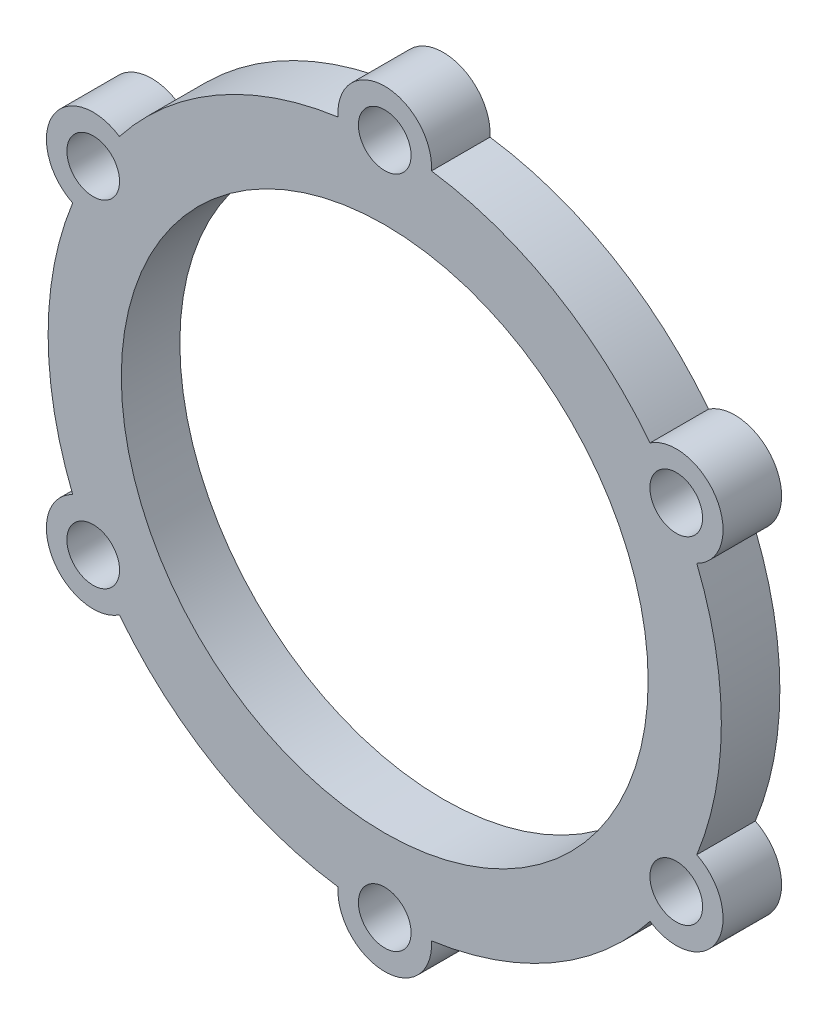
from build123d import *

# Parameters (mm, degrees)
SKETCH2_R           = 45
SKETCH2_R_2         = 4.5
BOSS_EXTRUDE1_DEPTH = 10


with BuildPart() as part:
    # Sketch2 → Boss-Extrude1 (new body)
    with BuildSketch(Plane(origin=(0, 0, 0), x_dir=(0, 1, 0), z_dir=(0, 0, 1))):
        with BuildLine():
            ThreePointArc((56.943478261, 7.980619246), (49.796460718, 28.75), (35.383158136, 45.324189131))
            ThreePointArc((35.383158136, 45.324189131), (32.75, 56.724663948), (21.560320125, 53.304808377))
            ThreePointArc((21.560320125, 53.304808377), (0, 57.5), (-21.560320125, 53.304808377))
            ThreePointArc((-21.560320125, 53.304808377), (-32.75, 56.724663948), (-35.383158136, 45.324189131))
            ThreePointArc((-35.383158136, 45.324189131), (-49.796460718, 28.75), (-56.943478261, 7.980619246))
            ThreePointArc((-56.943478261, 7.980619246), (-65.5, 0), (-56.943478261, -7.980619246))
            ThreePointArc((-56.943478261, -7.980619246), (-49.796460718, -28.75), (-35.383158136, -45.324189131))
            ThreePointArc((-35.383158136, -45.324189131), (-32.75, -56.724663948), (-21.560320125, -53.304808377))
            ThreePointArc((-21.560320125, -53.304808377), (0, -57.5), (21.560320125, -53.304808377))
            ThreePointArc((21.560320125, -53.304808377), (32.75, -56.724663948), (35.383158136, -45.324189131))
            ThreePointArc((35.383158136, -45.324189131), (49.796460718, -28.75), (56.943478261, -7.980619246))
            ThreePointArc((56.943478261, -7.980619246), (65.5, 0), (56.943478261, 7.980619246))
        make_face()
        with Locations(Location((0, 0, 0), (0, 0, 270))):
            Circle(SKETCH2_R, mode=Mode.SUBTRACT)
        with Locations(Location((28.75, 49.796460718, 0), (0, 0, 270))):
            Circle(SKETCH2_R_2, mode=Mode.SUBTRACT)
        with Locations(Location((-28.75, 49.796460718, 0), (0, 0, 270))):
            Circle(SKETCH2_R_2, mode=Mode.SUBTRACT)
        with Locations(Location((57.5, 0, 0), (0, 0, 270))):
            Circle(SKETCH2_R_2, mode=Mode.SUBTRACT)
        with Locations(Location((-57.5, 0, 0), (0, 0, 270))):
            Circle(SKETCH2_R_2, mode=Mode.SUBTRACT)
        with Locations(Location((28.75, -49.796460718, 0), (0, 0, 270))):
            Circle(SKETCH2_R_2, mode=Mode.SUBTRACT)
        with Locations(Location((-28.75, -49.796460718, 0), (0, 0, 270))):
            Circle(SKETCH2_R_2, mode=Mode.SUBTRACT)
    extrude(amount=BOSS_EXTRUDE1_DEPTH)


solid = part.part
